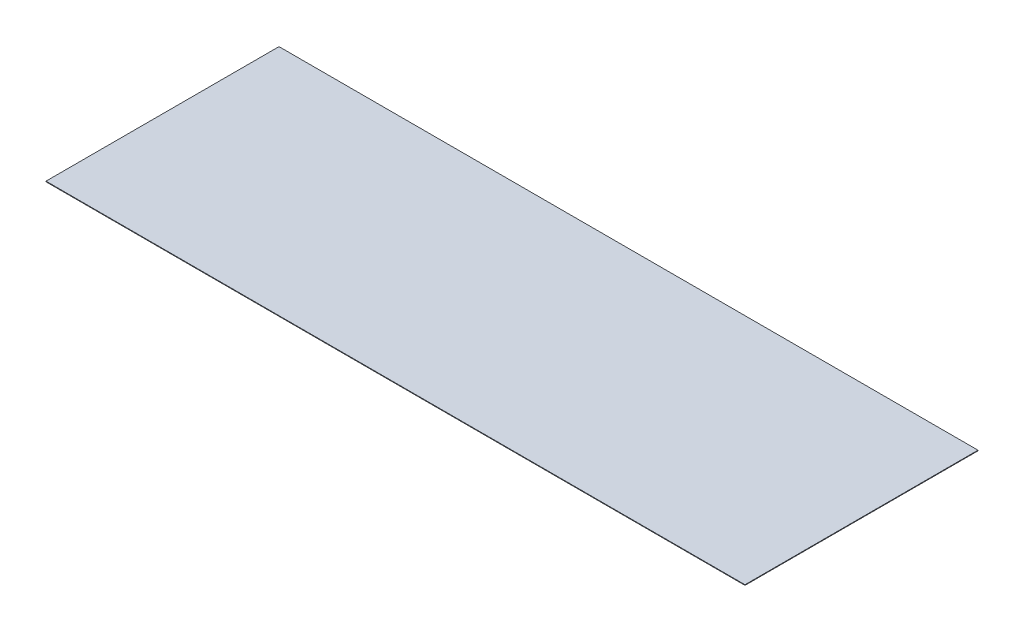
from build123d import *

# Parameters (mm, degrees)
ESQUISSE1_W        = 120
ESQUISSE1_H        = 40
BOSS_EXTRU_1_DEPTH = 0.1


with BuildPart() as part:
    # Esquisse1 → Boss.-Extru.1 (new body)
    with BuildSketch(Plane(origin=(0, 0, 0), x_dir=(1, 0, 0), z_dir=(0, 1, 0))):
        with Locations((-60, 20)):
            Rectangle(ESQUISSE1_W, ESQUISSE1_H)
    extrude(amount=BOSS_EXTRU_1_DEPTH)


solid = part.part
